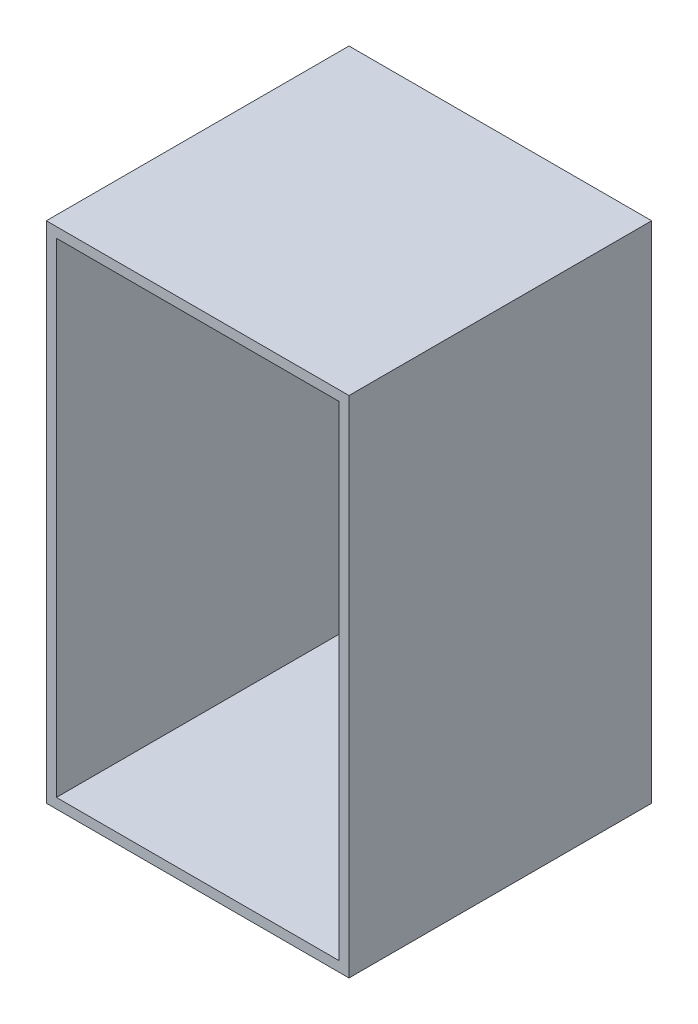
from build123d import *

# Parameters (mm, degrees)
SKETCH1_W                       = 76.2
SKETCH1_H                       = 76.2
BOX_DEPTH                       = 127
HOLLOW_IT_T                     = -2.54
SKETCH2_W                       = 4.318
SKETCH2_H                       = 63.5
SLIDER_TRACK_DEPTH              = 2.54
DPAD_LARGE_SHAPE_DEPTH          = 1.27
SKETCH7_R                       = 1.905
DPAD_TINY_HOLES_DEPTH           = 1.27
SKETCH8_R                       = 12.7
DIAL_LARGE_RING_DEPTH           = 1.27
SKETCH9_R                       = 5.08
DIAL_SMALL_HOLE_DEPTH           = 1.27
SKETCH12_W                      = 8.89
SKETCH12_H                      = 25.4
HOLE_FOR_SCROLL_WHEEL_DEPTH     = 2.54
SKETCH14_R                      = 6.35
NIBBLE_BASE_1_DEPTH             = 5.08
NIBBLE_START                    = -5.08
SKETCH15_R                      = 6.35
NIBBLE_BASE_2_DEPTH             = 5.08
NIBBLE_HOLES_REACH              = 145.381
SKETCH16_R                      = 3.302
NIBBLE_HOLES_DIRECTION_2_REACH  = 145.381
SINGLE_BUTTON_LEG_HOLE_DEPTH    = 2.54
MOAR_LEG_HOLES_COUNT            = 4
BASE_FOR_JOYSTICK_DEPTH         = 3.81
BASE_FOR_JOYSTICK_DEPTH_BACK    = 15.24
SKETCH19_W                      = 45.72
SKETCH19_H                      = 45.72
SKETCH21_W                      = 40.64
SKETCH21_H                      = 40.64
JOYSTICK_HOLE_DEPTH             = 155.861906549
LARGE_NIBBLES_REACH             = 148.689
SKETCH22_R                      = 3.175
LARGE_NIBBLES_DIRECTION_2_REACH = 148.689
SMALL_NIBBLES_REACH             = 134.524
SKETCH23_R                      = 4.445
SMALL_NIBBLES_DIRECTION_2_DEPTH = 48.26


with BuildPart() as part:
    # Sketch1 → box (new body)
    with BuildSketch(Plane(origin=(0, 0, 0), x_dir=(1, 0, 0), z_dir=(0, 1, 0))):
        Rectangle(SKETCH1_W, SKETCH1_H)
    extrude(amount=BOX_DEPTH)

    # hollow it
    hollow_it_openings = [part.faces().sort_by_distance(p)[0] for p in [
        (0, 63.5, 38.1),
    ]]
    offset(amount=HOLLOW_IT_T, openings=hollow_it_openings, kind=Kind.INTERSECTION)

    # Sketch2 → slider track (cut)
    with BuildSketch(Plane(origin=(0, 0, -38.1), x_dir=(-1, 0, 0), z_dir=(0, 0, -1))):
        with Locations((-27.051, 38.1)):
            Rectangle(SKETCH2_W, SKETCH2_H)
    extrude(amount=-SLIDER_TRACK_DEPTH, mode=Mode.SUBTRACT)

    # Sketch6 → dpad large shape (cut)
    with BuildSketch(Plane(origin=(0, 0, -38.1), x_dir=(-1, 0, 0), z_dir=(0, 0, -1))):
        Polygon((-3.297705804, 45.72), (-3.297705804, 52.07), (3.052294196, 52.07), (3.052294196, 45.72), (9.402294196, 45.72), (9.402294196, 39.37), (3.052294196, 39.37), (3.052294196, 33.02), (-3.297705804, 33.02), (-3.297705804, 39.37), (-9.647705804, 39.37), (-9.647705804, 45.72), align=None)
    extrude(amount=-DPAD_LARGE_SHAPE_DEPTH, mode=Mode.SUBTRACT)

    # Sketch7 → dpad tiny holes (cut)
    with BuildSketch(Plane(origin=(0, 0, -36.83), x_dir=(-1, 0, 0), z_dir=(0, 0, -1))):
        with Locations((-0.122705804, 48.895)):
            Circle(SKETCH7_R)
        with Locations((6.227294196, 42.672)):
            Circle(SKETCH7_R)
        with Locations((-0.122705804, 36.195)):
            Circle(SKETCH7_R)
        with Locations((-6.472705804, 42.545)):
            Circle(SKETCH7_R)
    extrude(amount=-DPAD_TINY_HOLES_DEPTH, mode=Mode.SUBTRACT)

    # Sketch8 → dial large ring (cut)
    with BuildSketch(Plane(origin=(0, 0, -38.1), x_dir=(-1, 0, 0), z_dir=(0, 0, -1))):
        with Locations((20.32, 19.05)):
            Circle(SKETCH8_R)
    extrude(amount=-DIAL_LARGE_RING_DEPTH, mode=Mode.SUBTRACT)

    # Sketch9 → dial small hole (cut)
    with BuildSketch(Plane(origin=(0, 0, -36.83), x_dir=(-1, 0, 0), z_dir=(0, 0, -1))):
        with Locations((20.32, 19.05)):
            Circle(SKETCH9_R)
    extrude(amount=-DIAL_SMALL_HOLE_DEPTH, mode=Mode.SUBTRACT)

    # Sketch12 → hole for scroll wheel (cut)
    with BuildSketch(Plane(origin=(0, 0, -38.1), x_dir=(-1, 0, 0), z_dir=(0, 0, -1))):
        with Locations((-6.985, 17.78)):
            Rectangle(SKETCH12_W, SKETCH12_H)
    extrude(amount=-HOLE_FOR_SCROLL_WHEEL_DEPTH, mode=Mode.SUBTRACT)

    # Sketch14 → nibble base 1 (add)
    with BuildSketch(Plane(origin=(2.54, 0, 0), x_dir=(0, 0, -1), z_dir=(1, 0, 0))):
        with Locations((38.1, 17.78)):
            Circle(SKETCH14_R)
    extrude(amount=-NIBBLE_BASE_1_DEPTH)

    # Sketch15 → nibble base 2 (add)
    with BuildSketch(Plane.ZY.offset(-11.43).offset(NIBBLE_START)):
        with Locations((-38.1, 17.78)):
            Circle(SKETCH15_R)
    extrude(amount=NIBBLE_BASE_2_DEPTH)

    # nibble holes: up to this face of the body (flat: up to its plane)
    nibble_holes_end = Plane(part.part.faces().sort_by_distance((16.51, 17.78, -40.795023703))[0])
    # Sketch16 → nibble holes (cut, up to the picked face)
    with BuildSketch(Plane.ZY.offset(-11.43), mode=Mode.PRIVATE) as nibble_holes_sk1:
        with Locations(Location((-38.1, 17.78, 0), (0, 0, 90))):
            Circle(SKETCH16_R)
    nibble_holes_tool1 = split(extrude(nibble_holes_sk1.sketch, amount=-NIBBLE_HOLES_REACH, mode=Mode.PRIVATE), bisect_by=nibble_holes_end, keep=Keep.BOTH, mode=Mode.PRIVATE)
    add(nibble_holes_tool1.solids().sort_by(Axis((11.43, 17.78, -38.1), (1, 0, 0)))[0], mode=Mode.SUBTRACT)

    # nibble holes direction 2: up to this face of the body (flat: up to its plane)
    nibble_holes_direction_2_end = Plane(part.part.faces().sort_by_distance((-2.54, 17.78, -40.795023703))[0])
    # Sketch16 → nibble holes direction 2 (cut, up to the picked face)
    with BuildSketch(Plane.ZY.offset(-11.43), mode=Mode.PRIVATE) as nibble_holes_direction_2_sk1:
        with Locations(Location((-38.1, 17.78, 0), (0, 0, 90))):
            Circle(SKETCH16_R)
    nibble_holes_direction_2_tool1 = split(extrude(nibble_holes_direction_2_sk1.sketch, amount=NIBBLE_HOLES_DIRECTION_2_REACH, mode=Mode.PRIVATE), bisect_by=nibble_holes_direction_2_end, keep=Keep.BOTH, mode=Mode.PRIVATE)
    add(nibble_holes_direction_2_tool1.solids().sort_by(Axis((11.43, 17.78, -38.1), (-1, 0, 0)))[0], mode=Mode.SUBTRACT)

    # Sketch17 → single button leg hole (cut)
    with BuildSketch(Plane(origin=(0, 0, -38.1), x_dir=(-1, 0, 0), z_dir=(0, 0, -1))):
        with BuildLine():
            Line((33.782, 65.405), (33.782, 61.595))
            ThreePointArc((33.782, 61.595), (31.75, 59.563), (29.718, 61.595))
            Line((29.718, 61.595), (29.718, 65.405))
            ThreePointArc((29.718, 65.405), (31.75, 67.437), (33.782, 65.405))
        make_face()
    single_button_leg_hole = extrude(amount=-SINGLE_BUTTON_LEG_HOLE_DEPTH, mode=Mode.SUBTRACT)

    # moar leg holes: single button leg hole ×4 about axis
    moar_leg_holes_axis = Axis((-25.4, 63.5, 0), (0, 0, 1))
    for i in range(1, MOAR_LEG_HOLES_COUNT):
        add(single_button_leg_hole.rotate(moar_leg_holes_axis, i * 360 / MOAR_LEG_HOLES_COUNT), mode=Mode.SUBTRACT)

    # Sketch19 → base for joystick (add, two sides: drawn at the far end of the back side and taken through both)
    with BuildSketch(Plane(origin=(0, 0, -38.1), x_dir=(-1, 0, 0), z_dir=(0, 0, -1)).offset(-BASE_FOR_JOYSTICK_DEPTH_BACK)):
        with Locations((0, 98.571636182)):
            Rectangle(SKETCH19_W, SKETCH19_H)
    extrude(amount=BASE_FOR_JOYSTICK_DEPTH + BASE_FOR_JOYSTICK_DEPTH_BACK)

    # Sketch21 → joystick hole (cut, through all)
    with BuildSketch(Plane(origin=(0, 0, -41.91), x_dir=(-1, 0, 0), z_dir=(0, 0, -1))):
        with Locations((0, 98.571636182)):
            Rectangle(SKETCH21_W, SKETCH21_H)
    extrude(amount=-JOYSTICK_HOLE_DEPTH, mode=Mode.SUBTRACT)

    # large nibbles: up to this face of the body (flat: up to its plane)
    large_nibbles_end = Plane(part.part.faces().sort_by_distance((-22.86, 98.571636182, -40.005))[0])
    # Sketch22 → large nibbles (cut, up to the picked face)
    with BuildSketch(Plane(origin=(-20.32, 0, 0), x_dir=(0, 0, -1), z_dir=(1, 0, 0)), mode=Mode.PRIVATE) as large_nibbles_sk1:
        with Locations((32.385, 98.571636182)):
            Circle(SKETCH22_R)
    large_nibbles_tool1 = split(extrude(large_nibbles_sk1.sketch, amount=-LARGE_NIBBLES_REACH, mode=Mode.PRIVATE), bisect_by=large_nibbles_end, keep=Keep.BOTH, mode=Mode.PRIVATE)
    add(large_nibbles_tool1.solids().sort_by(Axis((-20.32, 98.571636, -32.385), (-1, 0, 0)))[0], mode=Mode.SUBTRACT)

    # large nibbles direction 2: up to this face of the body (flat: up to its plane)
    large_nibbles_direction_2_end = Plane(part.part.faces().sort_by_distance((22.86, 98.571636182, -40.005))[0])
    # Sketch22 → large nibbles direction 2 (cut, up to the picked face)
    with BuildSketch(Plane(origin=(-20.32, 0, 0), x_dir=(0, 0, -1), z_dir=(1, 0, 0)), mode=Mode.PRIVATE) as large_nibbles_direction_2_sk1:
        with Locations((32.385, 98.571636182)):
            Circle(SKETCH22_R)
    large_nibbles_direction_2_tool1 = split(extrude(large_nibbles_direction_2_sk1.sketch, amount=LARGE_NIBBLES_DIRECTION_2_REACH, mode=Mode.PRIVATE), bisect_by=large_nibbles_direction_2_end, keep=Keep.BOTH, mode=Mode.PRIVATE)
    add(large_nibbles_direction_2_tool1.solids().sort_by(Axis((-20.32, 98.571636, -32.385), (1, 0, 0)))[0], mode=Mode.SUBTRACT)

    # small nibbles: up to this face of the body (flat: up to its plane)
    small_nibbles_end = Plane(part.part.faces().sort_by_distance((0, 124.46, 1.27))[0])
    # Sketch23 → small nibbles (cut, up to the picked face)
    with BuildSketch(Plane.XZ.offset(-118.891636182), mode=Mode.PRIVATE) as small_nibbles_sk1:
        with Locations(Location((0, -32.385, 0), (0, 0, 270))):
            Circle(SKETCH23_R)
    small_nibbles_tool1 = split(extrude(small_nibbles_sk1.sketch, amount=-SMALL_NIBBLES_REACH, mode=Mode.PRIVATE), bisect_by=small_nibbles_end, keep=Keep.BOTH, mode=Mode.PRIVATE)
    add(small_nibbles_tool1.solids().sort_by(Axis((0, 118.891636, -32.385), (0, 1, 0)))[0], mode=Mode.SUBTRACT)

    # Sketch23 → small nibbles direction 2 (cut)
    with BuildSketch(Plane.XZ.offset(-118.891636182)):
        with Locations(Location((0, -32.385, 0), (0, 0, 270))):
            Circle(SKETCH23_R)
    extrude(amount=SMALL_NIBBLES_DIRECTION_2_DEPTH, mode=Mode.SUBTRACT)


solid = part.part
